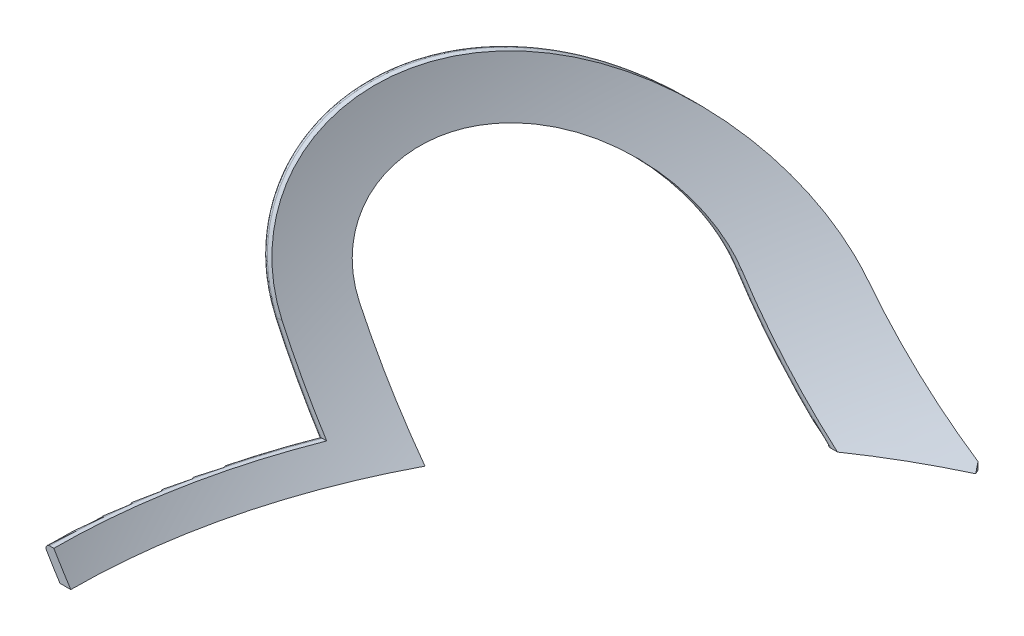
from build123d import *

# Parameters (mm, degrees)
REVOLVE1_ANGLE     = 130
SKETCH2_W          = 99.06
SKETCH2_H          = 9.525
CUT_EXTRUDE1_DEPTH = 340.527915992
FILLET1_R          = 1.27


with BuildPart() as part:
    # Sketch1 → Revolve1 (revolve, symmetric)
    with BuildSketch(Plane.XY) as revolve1_sk:
        with BuildLine():
            Line((-194.945, -11.795080514), (-198.72613444, -11.795080514))
            ThreePointArc((-198.72613444, -11.795080514), (-221.981484738, 33.976287639), (-235.681647174, 83.454919486))
            Line((-235.681647174, 83.454919486), (-232.45953717, 83.454919486))
            ThreePointArc((-232.45953717, 83.454919486), (-218.550660927, 33.920363635), (-194.945, -11.795080514))
        make_face()
    revolve(axis=Axis((17.78, 127, 0), (0, 1, 0)), revolution_arc=REVOLVE1_ANGLE / 2)
    revolve(revolve1_sk.sketch, axis=Axis((17.78, 127, 0), (0, -1, 0)), revolution_arc=REVOLVE1_ANGLE / 2)

    # Sketch2 → Cut-Extrude1 (cut, through all)
    with BuildSketch(Plane(origin=(0, 0, 0), x_dir=(0, 0, -1), z_dir=(1, 0, 0))):
        with BuildLine():
            Line((194.31, 26.304919486), (194.31, -11.795080514))
            Line((194.31, -11.795080514), (196.221195584, -11.795080514))
            add(Edge.make_bspline(
                [(196.221195584, -11.795080514), (221.715706378, 32.084968528), (229.714264549, 83.454919486)],
                knots=[4.142318737, 4.142318737, 4.142318737, 4.542248488, 4.542248488, 4.542248488], degree=2, weights=[1, 0.980073555, 1]))
            Line((229.714264549, 83.454919486), (137.160000039, 83.454919486))
            ThreePointArc((137.160000039, 83.454919486), (177.571152559, 66.716072016), (194.31, 26.304919486))
        make_face()
        with BuildLine():
            Line((0, -2.270080514), (80.01, -2.270080514))
            Line((80.01, -2.270080514), (80.01, 26.304919486))
            ThreePointArc((80.01, 26.304919486), (96.748847469, 66.716072044), (137.160000039, 83.454919486))
            Line((137.160000039, 83.454919486), (0, 83.454919486))
            Line((0, 83.454919486), (0, -2.270080514))
        make_face()
        with BuildLine():
            Line((-99.06, -2.270080514), (0, -2.270080514))
            Line((0, -2.270080514), (0, 83.454919486))
            Line((0, 83.454919486), (-229.714264549, 83.454919486))
            add(Edge.make_bspline(
                [(-229.714264549, 83.454919486), (-221.715706378, 32.084968528), (-196.221195584, -11.795080514)],
                knots=[1.740936819, 1.740936819, 1.740936819, 2.14086657, 2.14086657, 2.14086657], degree=2, weights=[1, 0.980073555, 1]))
            Line((-196.221195584, -11.795080514), (-175.26, -11.795080514))
            Line((-175.26, -11.795080514), (-175.26, 26.304919486))
            ThreePointArc((-175.26, 26.304919486), (-137.16, 64.404919486), (-99.06, 26.304919486))
            Line((-99.06, 26.304919486), (-99.06, -2.270080514))
        make_face()
        with Locations((-49.53, -7.032580514)):
            Rectangle(SKETCH2_W, SKETCH2_H)
        with BuildLine():
            Line((-175.26, -11.795080514), (-99.06, -11.795080514))
            Line((-99.06, -11.795080514), (-99.06, -2.270080514))
            Line((-99.06, -2.270080514), (-99.06, 26.304919486))
            ThreePointArc((-99.06, 26.304919486), (-137.16, 64.404919486), (-175.26, 26.304919486))
            Line((-175.26, 26.304919486), (-175.26, -11.795080514))
        make_face()
        with BuildLine():
            ThreePointArc((175.26, 26.304919486), (137.16, 64.404919486), (99.06, 26.304919486))
            Line((99.06, 26.304919486), (99.06, -11.795080514))
            Line((99.06, -11.795080514), (175.26, -11.795080514))
            Line((175.26, -11.795080514), (175.26, 26.304919486))
        make_face()
    extrude(amount=-CUT_EXTRUDE1_DEPTH, mode=Mode.SUBTRACT)

    # Fillet1
    fillet1_edges = [part.edges().sort_by_distance(p)[0] for p in [
        (-188.406041829, 82.575236344, -147.14869063),
        (-99.062434014, 5.630934177, -194.31),
        (-200.788877571, -2.270080514, -40.692415337),
        (-197.761268455, 11.763972136, -80.01),
        (-186.468133143, 63.955709956, -142.993350279),
        (-126.545268016, 6.197971718, -175.26),
        (-186.82161556, 6.732481794, -99.06),
    ]]
    fillet(fillet1_edges, radius=FILLET1_R)


solid = part.part
